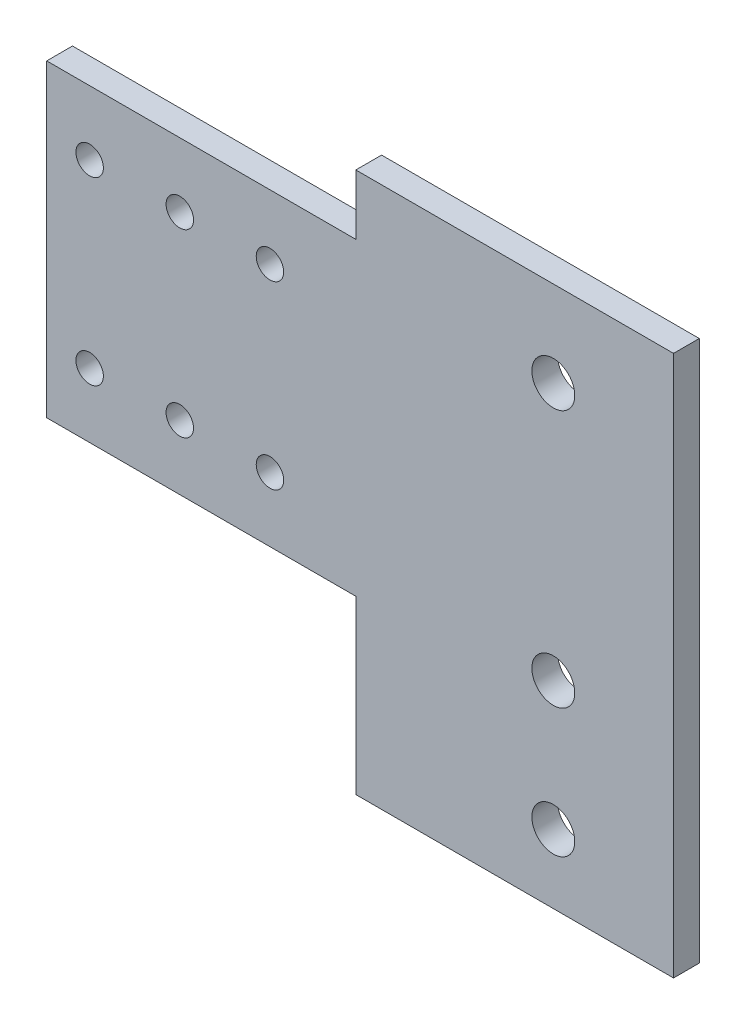
from build123d import *

# Parameters (mm, degrees)
EXTRUDE_1_DEPTH     = 3
SKETCH_2_R          = 1.6
CUT_EXTRUDE_1_DEPTH = 93.054331783
SKETCH_3_R          = 2.5
CUT_EXTRUDE_2_DEPTH = 93.054331783
SKETCH_4_R          = 2.5
CUT_EXTRUDE_3_DEPTH = 93.054331783
SKETCH_5_W          = 37
SKETCH_5_H          = 13
CUT_EXTRUDE_4_DEPTH = 93.054331783


with BuildPart() as part:
    # 草图1 → 凸台-拉伸1 (new body)
    with BuildSketch(Plane.XY):
        Polygon((0, 0), (36, 0), (36, 20), (73, 20), (73, -56), (36, -56), (36, -36), (0, -36), align=None)
    extrude(amount=EXTRUDE_1_DEPTH)

    # 草图2 → 切除-拉伸1 (cut, through all)
    with BuildSketch(Plane(origin=(0, 0, 0), x_dir=(-1, 0, 0), z_dir=(0, 0, -1))):
        with Locations((-26, -7.5)):
            Circle(SKETCH_2_R)
        with Locations((-26, -28.5)):
            Circle(SKETCH_2_R)
        with Locations((-5, -7.5)):
            Circle(SKETCH_2_R)
        with Locations((-5, -28.5)):
            Circle(SKETCH_2_R)
        with Locations((-15.5, -28.5)):
            Circle(SKETCH_2_R)
        with Locations((-15.5, -7.5)):
            Circle(SKETCH_2_R)
    extrude(amount=-CUT_EXTRUDE_1_DEPTH, mode=Mode.SUBTRACT)

    # 草图3 → 切除-拉伸2 (cut, through all)
    with BuildSketch(Plane(origin=(0, 0, 0), x_dir=(-1, 0, 0), z_dir=(0, 0, -1))):
        with Locations((-59, -33)):
            Circle(SKETCH_3_R)
        with Locations((-59, -48)):
            Circle(SKETCH_3_R)
    extrude(amount=-CUT_EXTRUDE_2_DEPTH, mode=Mode.SUBTRACT)

    # 草图4 → 切除-拉伸3 (cut, through all)
    with BuildSketch(Plane(origin=(0, 0, 0), x_dir=(-1, 0, 0), z_dir=(0, 0, -1))):
        with Locations((-59, -3)):
            Circle(SKETCH_4_R)
        with Locations((-59, 12)):
            Circle(SKETCH_4_R)
    extrude(amount=-CUT_EXTRUDE_3_DEPTH, mode=Mode.SUBTRACT)

    # 草图5 → 切除-拉伸4 (cut, through all)
    with BuildSketch(Plane.XY.offset(3)):
        with Locations((54.5, 13.5)):
            Rectangle(SKETCH_5_W, SKETCH_5_H)
    extrude(amount=-CUT_EXTRUDE_4_DEPTH, mode=Mode.SUBTRACT)


solid = part.part
